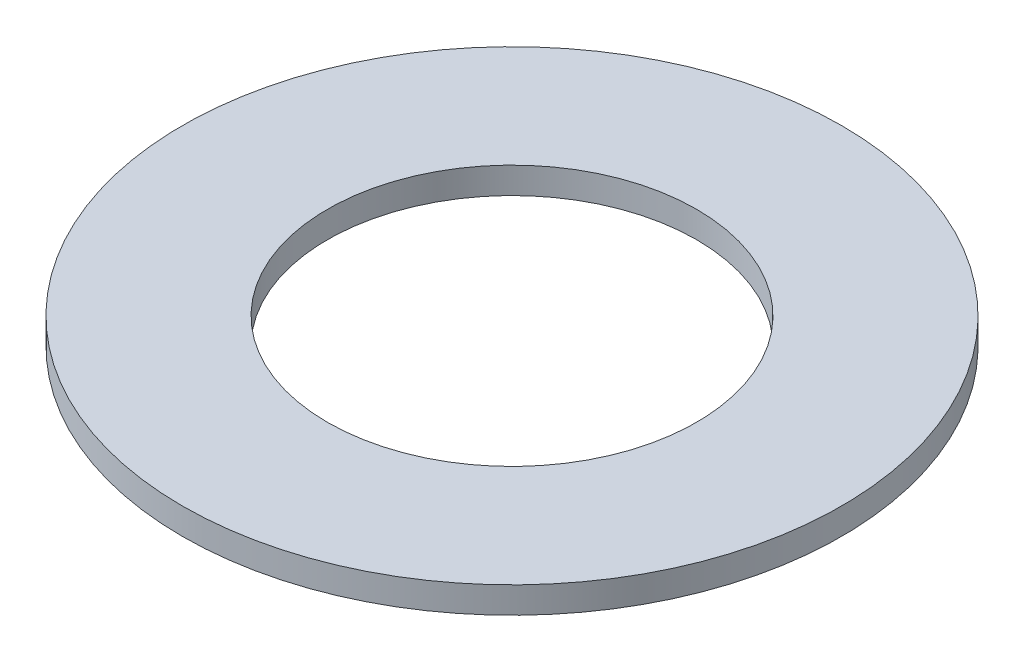
from build123d import *

# Parameters (mm, degrees)
CROQUIS1_R              = 25
SALIENTE_EXTRUIR1_DEPTH = 2
CROQUIS2_R              = 14
CORTAR_EXTRUIR1_DEPTH   = 36.411862419


with BuildPart() as part:
    # Croquis1 → Saliente-Extruir1 (new body)
    with BuildSketch(Plane(origin=(0, 0, 0), x_dir=(1, 0, 0), z_dir=(0, 1, 0))):
        with Locations(Location((0, 0, 0), (0, 0, 270))):
            Circle(CROQUIS1_R)
    extrude(amount=SALIENTE_EXTRUIR1_DEPTH)

    # Croquis2 → Cortar-Extruir1 (cut, through all)
    with BuildSketch(Plane(origin=(0, 2, 0), x_dir=(1, 0, 0), z_dir=(0, 1, 0))):
        with Locations(Location((0, 0, 0), (0, 0, 270))):
            Circle(CROQUIS2_R)
    extrude(amount=-CORTAR_EXTRUIR1_DEPTH, mode=Mode.SUBTRACT)


solid = part.part
